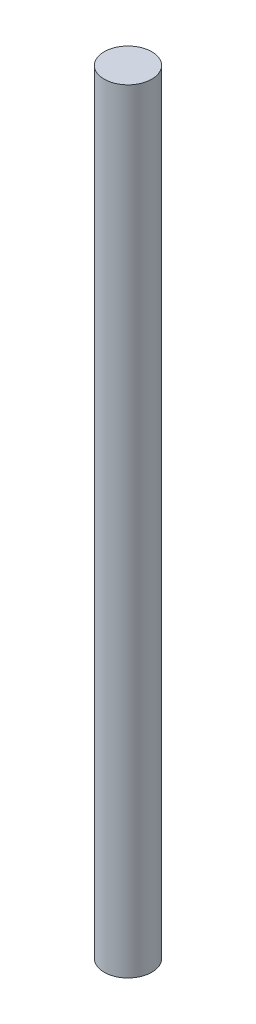
from build123d import *

# Parameters (mm, degrees)
ESBO_O1_R                = 10
RESSALTO_EXTRUS_O1_DEPTH = 325


with BuildPart() as part:
    # Esboço1 → Ressalto-extrusão1 (new body)
    with BuildSketch(Plane(origin=(0, 0, 0), x_dir=(1, 0, 0), z_dir=(0, 1, 0))):
        with Locations(Location((0, 0, 0), (0, 0, 270))):
            Circle(ESBO_O1_R)
    extrude(amount=RESSALTO_EXTRUS_O1_DEPTH)


solid = part.part
